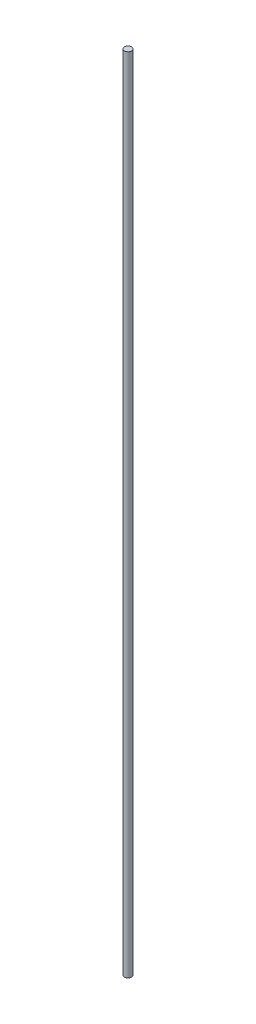
from build123d import *

# Parameters (mm, degrees)
SKETCH1_R           = 4
BOSS_EXTRUDE1_DEPTH = 887.03
SKETCH2_R           = 4
BOSS_EXTRUDE2_DEPTH = 18


with BuildPart() as part:
    # Sketch1 → Boss-Extrude1 (new body)
    with BuildSketch(Plane(origin=(0, 0, 0), x_dir=(1, 0, 0), z_dir=(0, 1, 0))):
        with Locations(Location((0, 0, 0), (0, 0, 90))):
            Circle(SKETCH1_R)
    extrude(amount=BOSS_EXTRUDE1_DEPTH)

    # Sketch2 → Boss-Extrude2 (add)
    with BuildSketch(Plane(origin=(0, 887.03, 0), x_dir=(1, 0, 0), z_dir=(0, 1, 0))):
        with Locations(Location((0, 0, 0), (0, 0, 90))):
            Circle(SKETCH2_R)
    extrude(amount=BOSS_EXTRUDE2_DEPTH)


solid = part.part
